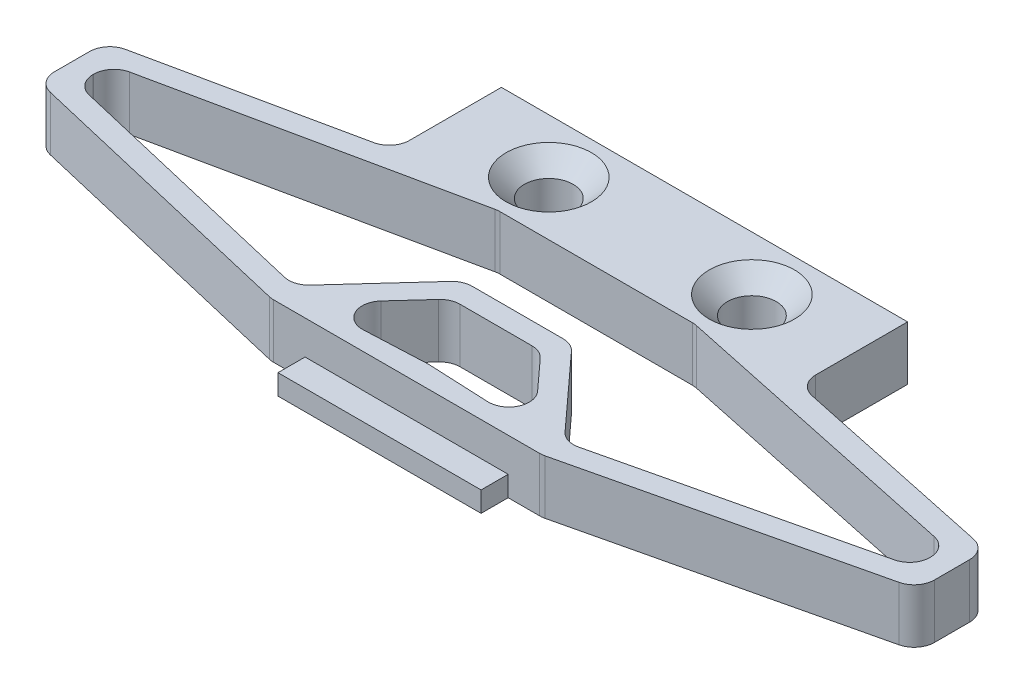
from build123d import *

# Parameters (mm, degrees)
BOSS_EXTRUDE1_DEPTH                                 = 4
FILLET1_R                                           = 1.5
CSK_FOR_M3_COUNTERSUNK_FLAT_HEAD_SCREW1_D           = 3.6
CSK_FOR_M3_COUNTERSUNK_FLAT_HEAD_SCREW1_CSINK_D     = 6.3
CSK_FOR_M3_COUNTERSUNK_FLAT_HEAD_SCREW1_CSINK_ANGLE = 90
SKETCH5_W                                           = 7.5
SKETCH5_H                                           = 1.5
BOSS_EXTRUDE2_DEPTH                                 = 2


with BuildPart() as part:
    # Sketch1 → Boss-Extrude1 (new body)
    with BuildSketch(Plane(origin=(0, 0, 0), x_dir=(1, 0, 0), z_dir=(0, 1, 0))):
        Polygon((0, 0), (-15, 0), (-15, -8), (-32.5, -11.703142934), (-32.5, -16.703142934), (-10, -22), (0, -22), (0, -20.4), (-8.217014563, -20.776004397), (-3.311485397, -15.4), (0, -15.4), (0, -13.8), (-4.017502815, -13.8), (-10, -20.356261329), (-30.9, -15.436069655), (-30.9, -13), (-7.271422452, -8), (0, -8), align=None)
    extrude(amount=BOSS_EXTRUDE1_DEPTH)

    # Fillet1
    fillet1_edges = [part.edges().sort_by_distance(p)[0] for p in [
        (-7.271422452, 2, 8),
        (-30.9, 2, 13),
        (-30.9, 2, 15.436069655),
        (-10, 2, 20.356261329),
        (-4.017502815, 2, 13.8),
        (-3.311485397, 2, 15.4),
        (-8.217014563, 2, 20.776004397),
        (-10, 2, 22),
        (-32.5, 2, 16.703142934),
        (-32.5, 2, 11.703142934),
        (-15, 2, 8),
    ]]
    fillet(fillet1_edges, radius=FILLET1_R)

    # CSK for M3 Countersunk Flat Head Screw1 (through all)
    with Locations(Plane(origin=(0, 4, 0), x_dir=(1, 0, 0), z_dir=(0, 1, 0))):
        with Locations((-7.5, -4)):
            CounterSinkHole(CSK_FOR_M3_COUNTERSUNK_FLAT_HEAD_SCREW1_D / 2, CSK_FOR_M3_COUNTERSUNK_FLAT_HEAD_SCREW1_CSINK_D / 2, counter_sink_angle=CSK_FOR_M3_COUNTERSUNK_FLAT_HEAD_SCREW1_CSINK_ANGLE)

    # Sketch5 → Boss-Extrude2 (add)
    with BuildSketch(Plane.XY.offset(22)):
        with Locations((-3.75, 0.75)):
            Rectangle(SKETCH5_W, SKETCH5_H)
    extrude(amount=BOSS_EXTRUDE2_DEPTH)

    # Mirror1: part across plane


with BuildPart() as part_1:
    add(part.part)
    add(part.part.mirror(Plane(origin=(0, 4, 8), x_dir=(0, 0, 1), z_dir=(-1, 0, 0))))


solid = part_1.part
